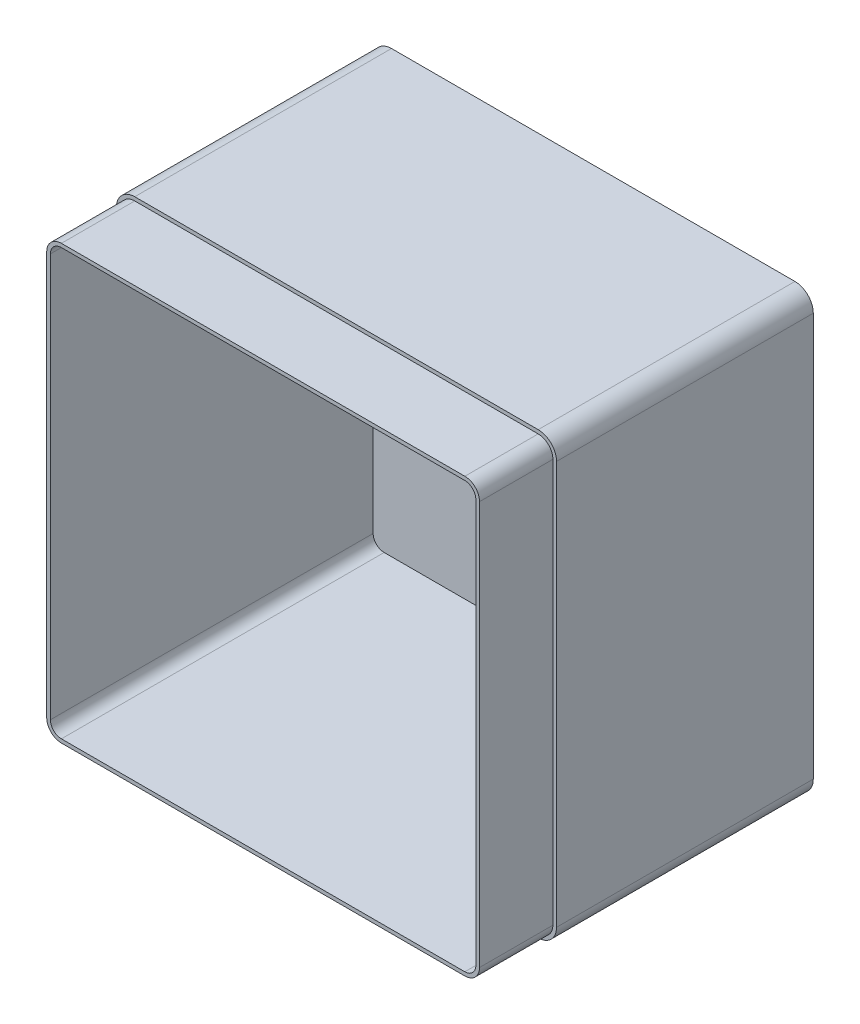
from build123d import *

# Parameters (mm, degrees)
ESQUISSE1_W             = 120
ESQUISSE1_H             = 120
BOSS_EXTRU_1_DEPTH      = 90
CONG_1_R                = 5
COQUE1_T                = -2
ENL_V_MAT_EXTRU_2_DEPTH = 20


with BuildPart() as part:
    # Esquisse1 → Boss.-Extru.1 (new body)
    with BuildSketch(Plane.XY):
        with Locations((60, 60)):
            Rectangle(ESQUISSE1_W, ESQUISSE1_H)
    extrude(amount=BOSS_EXTRU_1_DEPTH)

    # Congé1
    cong_1_edges = [part.edges().sort_by_distance(p)[0] for p in [
        (0, 120, 45),
        (120, 120, 45),
        (120, 0, 45),
        (0, 0, 45),
    ]]
    fillet(cong_1_edges, radius=CONG_1_R)

    # Coque1
    coque1_openings = [part.faces().sort_by_distance(p)[0] for p in [
        (60, 60, 90),
    ]]
    offset(amount=COQUE1_T, openings=coque1_openings, kind=Kind.INTERSECTION)

    # Esquisse4 → Enlèv. mat.-Extru.2 (cut)
    with BuildSketch(Plane.XY.offset(90)):
        with BuildLine():
            Line((0, 115), (0, 5))
            ThreePointArc((0, 5), (1.464466094, 1.464466094), (5, 0))
            Line((5, 0), (115, 0))
            ThreePointArc((115, 0), (118.535533906, 1.464466094), (120, 5))
            Line((120, 5), (120, 115))
            ThreePointArc((120, 115), (118.535533906, 118.535533906), (115, 120))
            Line((115, 120), (5, 120))
            ThreePointArc((5, 120), (1.464466094, 118.535533906), (0, 115))
        make_face()
        with BuildLine():
            Line((1, 115), (1, 5))
            ThreePointArc((1, 5), (2.171572875, 2.171572875), (5, 1))
            Line((5, 1), (115, 1))
            ThreePointArc((115, 1), (117.828427125, 2.171572875), (119, 5))
            Line((119, 5), (119, 115))
            ThreePointArc((119, 115), (117.828427125, 117.828427125), (115, 119))
            Line((115, 119), (5, 119))
            ThreePointArc((5, 119), (2.171572875, 117.828427125), (1, 115))
        make_face(mode=Mode.SUBTRACT)
    extrude(amount=-ENL_V_MAT_EXTRU_2_DEPTH, mode=Mode.SUBTRACT)


solid = part.part
